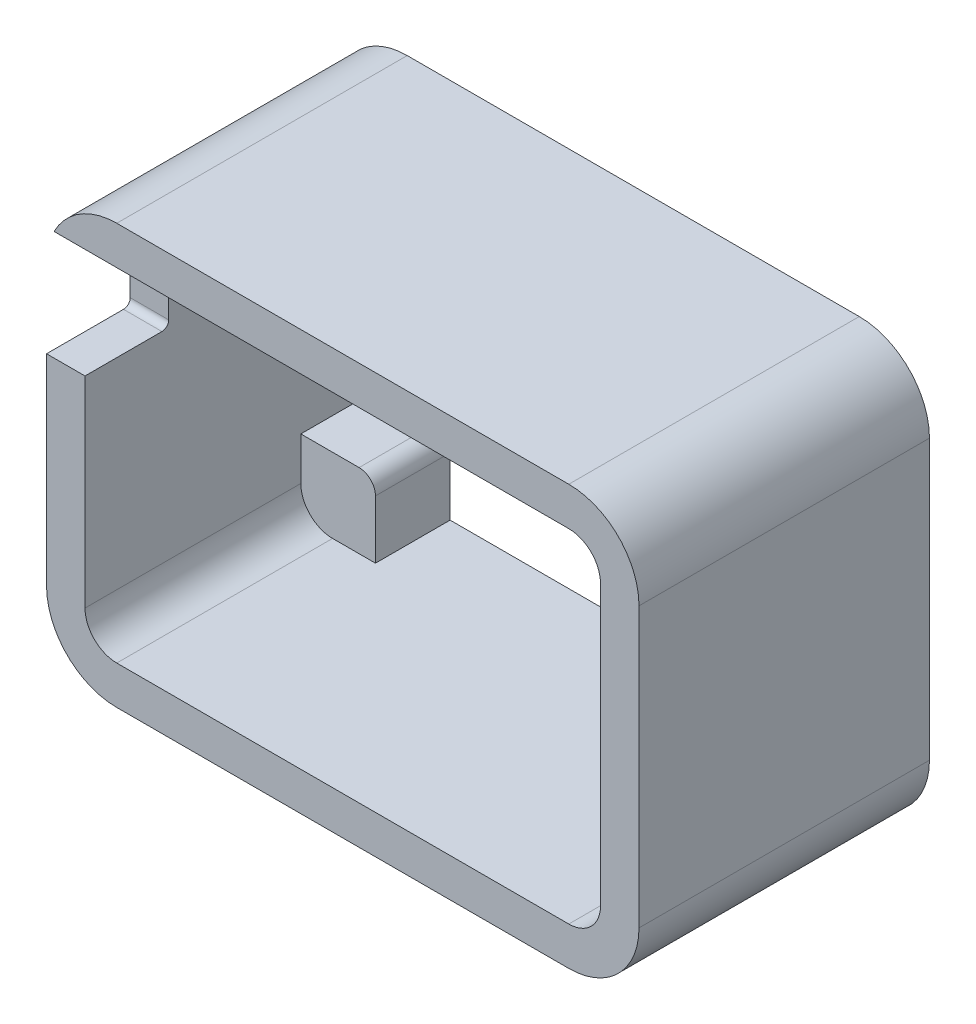
from build123d import *

# Parameters (mm, degrees)
EXTRUDE_1_DEPTH     = 15.1
EXTRUDE_START       = -3.88
EXTRUDE_2_DEPTH     = 3.88
CUT_EXTRUDE_1_REACH = 37.992


with BuildPart() as part:
    # 草图1 → 凸台-拉伸1 (new body)
    with BuildSketch(Plane.XY):
        with BuildLine():
            Line((-15.4, 3.2), (-15.4, 7.25))
            ThreePointArc((-15.4, 7.25), (-14.330939751, 9.830939751), (-11.75, 10.9))
            Line((-11.75, 10.9), (11.75, 10.9))
            ThreePointArc((11.75, 10.9), (14.330939751, 9.830939751), (15.4, 7.25))
            Line((15.4, 7.25), (15.4, -7.25))
            ThreePointArc((15.4, -7.25), (14.330939751, -9.830939751), (11.75, -10.9))
            Line((11.75, -10.9), (3.85, -10.9))
            Line((3.85, -10.9), (-3.85, -10.9))
            Line((-3.85, -10.9), (-11.75, -10.9))
            ThreePointArc((-11.75, -10.9), (-14.330939751, -9.830939751), (-15.4, -7.25))
            Line((-15.4, -7.25), (-15.4, 3.2))
        make_face()
        with BuildLine():
            Line((-13.4, 3.2), (-13.4, 7.25))
            ThreePointArc((-13.4, 7.25), (-12.916726189, 8.416726189), (-11.75, 8.9))
            Line((-11.75, 8.9), (11.75, 8.9))
            ThreePointArc((11.75, 8.9), (12.916726189, 8.416726189), (13.4, 7.25))
            Line((13.4, 7.25), (13.4, -7.25))
            ThreePointArc((13.4, -7.25), (12.916726189, -8.416726189), (11.75, -8.9))
            Line((11.75, -8.9), (3.85, -8.9))
            Line((3.85, -8.9), (-3.85, -8.9))
            Line((-3.85, -8.9), (-11.75, -8.9))
            ThreePointArc((-11.75, -8.9), (-12.916726189, -8.416726189), (-13.4, -7.25))
            Line((-13.4, -7.25), (-13.4, 3.2))
        make_face(mode=Mode.SUBTRACT)
    extrude(amount=-EXTRUDE_1_DEPTH)

    # 草图2 → 凸台-拉伸2 (add)
    with BuildSketch(Plane(origin=(0, 0, -15.1), x_dir=(-1, 0, 0), z_dir=(0, 0, -1)).offset(EXTRUDE_START)):
        with BuildLine():
            Line((-13.4, 6.82), (-13.25, 6.82))
            Line((-13.25, 6.82), (-11.67, 6.82))
            ThreePointArc((-11.67, 6.82), (-11.422512627, 6.922512627), (-11.32, 7.17))
            Line((-11.32, 7.17), (-11.32, 8.75))
            Line((-11.32, 8.75), (-11.32, 8.9))
            Line((-11.32, 8.9), (-11.75, 8.9))
            ThreePointArc((-11.75, 8.9), (-12.916726189, 8.416726189), (-13.4, 7.25))
            Line((-13.4, 7.25), (-13.4, 6.82))
        make_face()
        with BuildLine():
            Line((-13.25, -5.02), (-13.4, -5.02))
            Line((-13.4, -5.02), (-13.4, -7.25))
            ThreePointArc((-13.4, -7.25), (-12.916726189, -8.416726189), (-11.75, -8.9))
            Line((-11.75, -8.9), (-9.52, -8.9))
            Line((-9.52, -8.9), (-9.52, -8.75))
            Line((-9.52, -8.75), (-9.52, -5.87))
            ThreePointArc((-9.52, -5.87), (-9.768959236, -5.268959236), (-10.37, -5.02))
            Line((-10.37, -5.02), (-13.25, -5.02))
        make_face()
        with BuildLine():
            Line((9.52, -8.75), (9.52, -8.9))
            Line((9.52, -8.9), (11.75, -8.9))
            ThreePointArc((11.75, -8.9), (12.916726189, -8.416726189), (13.4, -7.25))
            Line((13.4, -7.25), (13.4, -5.02))
            Line((13.4, -5.02), (13.25, -5.02))
            Line((13.25, -5.02), (10.37, -5.02))
            ThreePointArc((10.37, -5.02), (9.768959236, -5.268959236), (9.52, -5.87))
            Line((9.52, -5.87), (9.52, -8.75))
        make_face()
        with BuildLine():
            Line((11.75, 8.9), (11.32, 8.9))
            Line((11.32, 8.9), (11.32, 8.75))
            Line((11.32, 8.75), (11.32, 7.17))
            ThreePointArc((11.32, 7.17), (11.422512627, 6.922512627), (11.67, 6.82))
            Line((11.67, 6.82), (13.25, 6.82))
            Line((13.25, 6.82), (13.4, 6.82))
            Line((13.4, 6.82), (13.4, 7.25))
            ThreePointArc((13.4, 7.25), (12.916726189, 8.416726189), (11.75, 8.9))
        make_face()
    extrude(amount=EXTRUDE_2_DEPTH)

    # 草图3 → 切除-拉伸1 (cut, up to next)
    with BuildSketch(Plane.ZY.offset(15.4), mode=Mode.PRIVATE) as cut_extrude_1_sk1:
        with BuildLine():
            Line((0.15, 8.9), (-4, 8.9))
            ThreePointArc((-4, 8.9), (-4.247487373, 8.797487373), (-4.35, 8.55))
            Line((-4.35, 8.55), (-4.35, 3.55))
            ThreePointArc((-4.35, 3.55), (-4.247487373, 3.302512627), (-4, 3.2))
            Line((-4, 3.2), (0.15, 3.2))
            Line((0.15, 3.2), (0.15, 8.9))
        make_face()
    cut_extrude_1_tool1 = extrude(cut_extrude_1_sk1.sketch, amount=-CUT_EXTRUDE_1_REACH, mode=Mode.PRIVATE) & part.part
    add(cut_extrude_1_tool1.solids().sort_by_distance((-15.4, 6.05, -2.095539))[0], mode=Mode.SUBTRACT)


solid = part.part
